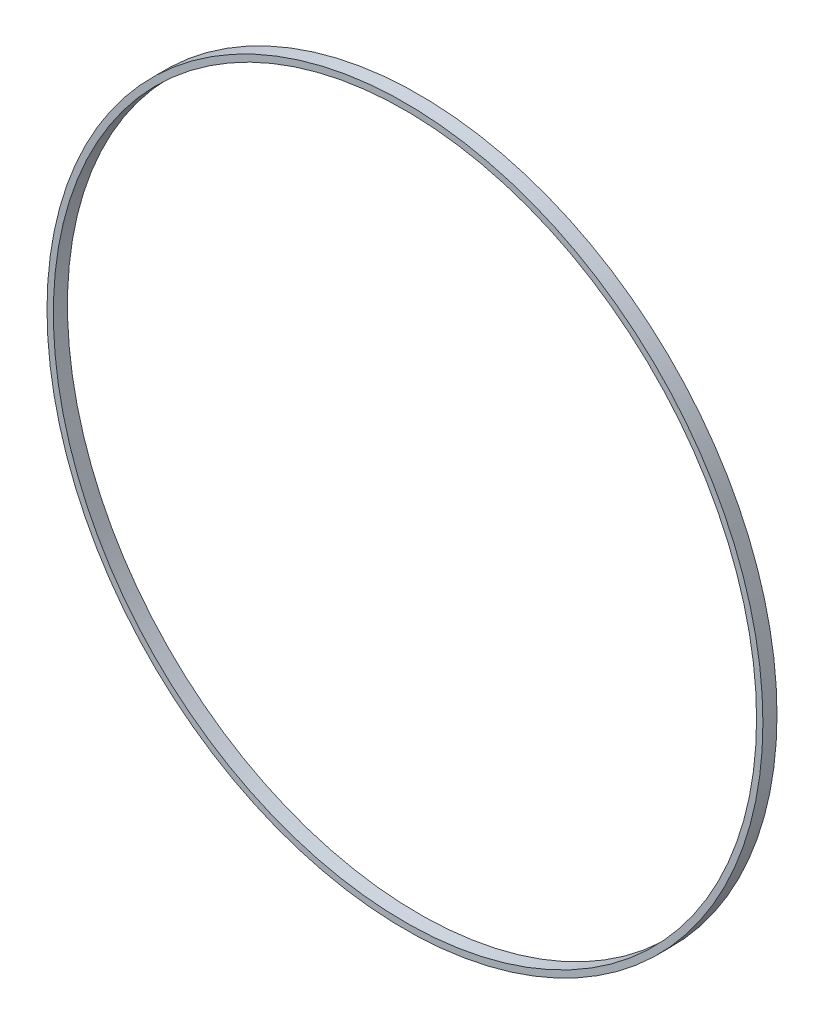
from build123d import *

# Parameters (mm, degrees)
ESQUISSE1_R        = 20.31
ESQUISSE1_R_2      = 19.95
BOSS_EXTRU_1_DEPTH = 0.8


with BuildPart() as part:
    # Esquisse1 → Boss.-Extru.1 (new body)
    with BuildSketch(Plane.XY):
        Circle(ESQUISSE1_R)
        Circle(ESQUISSE1_R_2, mode=Mode.SUBTRACT)
    extrude(amount=BOSS_EXTRU_1_DEPTH)


solid = part.part
